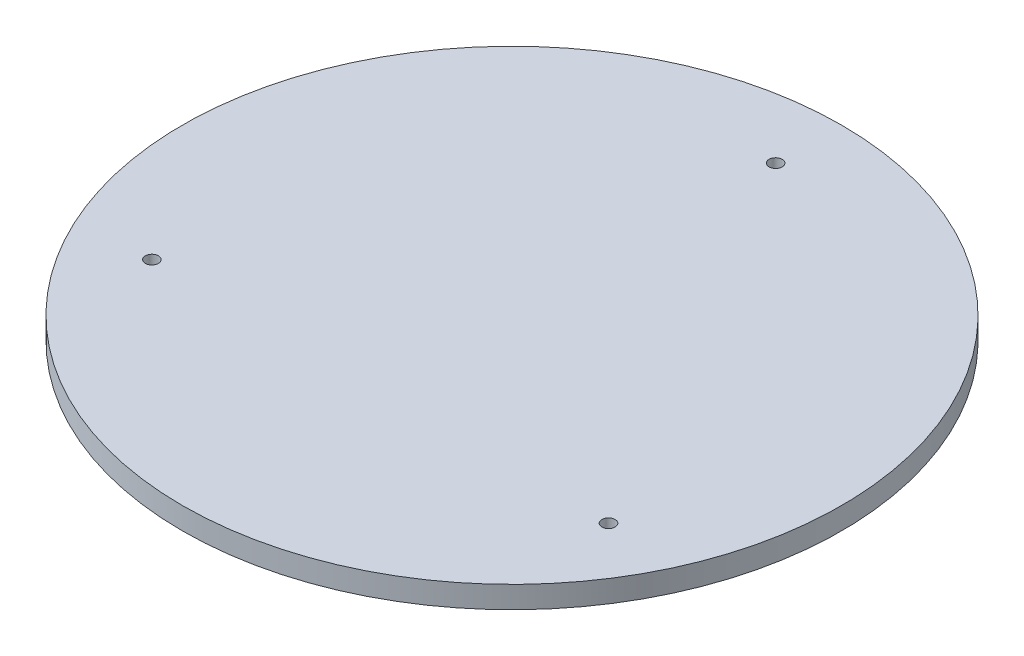
from build123d import *

# Parameters (mm, degrees)
SKETCH1_R           = 75
BOSS_EXTRUDE1_DEPTH = 5
SKETCH2_R           = 1.5
CUT_EXTRUDE1_DEPTH  = 107.183802908


with BuildPart() as part:
    # Sketch1 → Boss-Extrude1 (new body)
    with BuildSketch(Plane(origin=(0, 0, 0), x_dir=(1, 0, 0), z_dir=(0, 1, 0))):
        with Locations(Location((0, 0, 0), (0, 0, 270))):
            Circle(SKETCH1_R)
    extrude(amount=BOSS_EXTRUDE1_DEPTH)

    # Sketch2 → Cut-Extrude1 (cut, through all)
    with BuildSketch(Plane(origin=(0, 5, 0), x_dir=(1, 0, 0), z_dir=(0, 1, 0))):
        with Locations(Location((0, 60, 0), (0, 0, 270))):
            Circle(SKETCH2_R)
        with Locations(Location((51.961524227, -30, 0), (0, 0, 270))):
            Circle(SKETCH2_R)
        with Locations(Location((-51.961524227, -30, 0), (0, 0, 270))):
            Circle(SKETCH2_R)
    extrude(amount=-CUT_EXTRUDE1_DEPTH, mode=Mode.SUBTRACT)


solid = part.part
